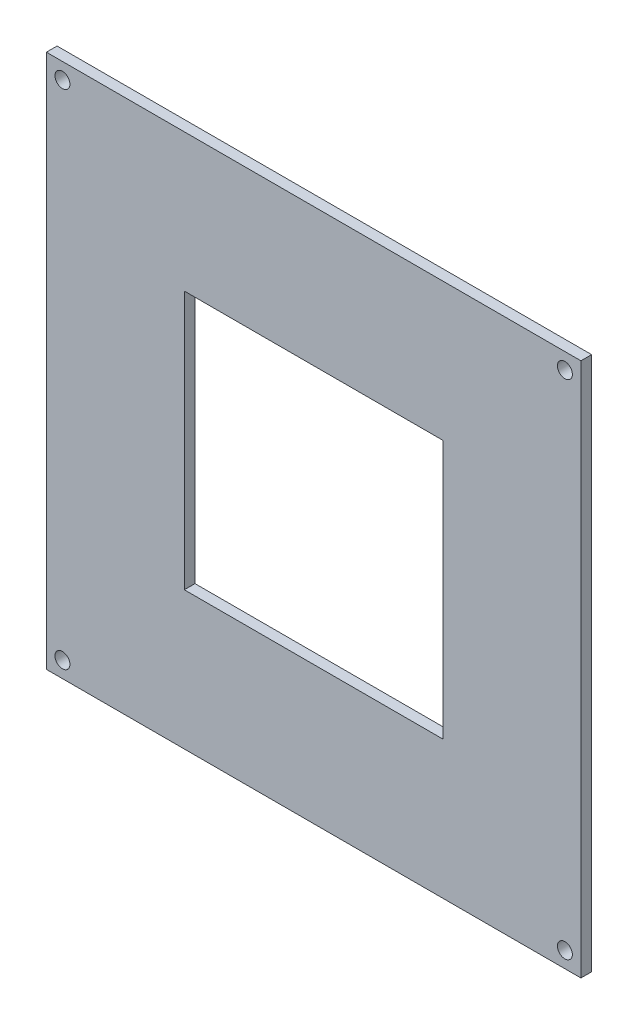
from build123d import *

# Parameters (mm, degrees)
ESBO_O1_W                = 250
ESBO_O1_H                = 250
RESSALTO_EXTRUS_O1_DEPTH = 5
ESBO_O2_R                = 3.5
CORTE_EXTRUS_O1_DEPTH    = 177.847391838
ESBO_O3_W                = 121
ESBO_O3_H                = 121
CORTE_EXTRUS_O2_DEPTH    = 177.847391838


with BuildPart() as part:
    # Esboço1 → Ressalto-extrusão1 (new body)
    with BuildSketch(Plane.XY):
        Rectangle(ESBO_O1_W, ESBO_O1_H)
    extrude(amount=RESSALTO_EXTRUS_O1_DEPTH)

    # Esboço2 → Corte-extrusão1 (cut, through all)
    with BuildSketch(Plane.XY.offset(5)):
        with Locations((-117.5, 117.5)):
            Circle(ESBO_O2_R)
        with Locations(Location((117.5, 117.5, 0), (0, 0, 180))):
            Circle(ESBO_O2_R)
        with Locations(Location((-117.5, -117.5, 0), (0, 0, 180))):
            Circle(ESBO_O2_R)
        with Locations((117.5, -117.5)):
            Circle(ESBO_O2_R)
    extrude(amount=-CORTE_EXTRUS_O1_DEPTH, mode=Mode.SUBTRACT)

    # Esboço3 → Corte-extrusão2 (cut, through all)
    with BuildSketch(Plane.XY.offset(5)):
        Rectangle(ESBO_O3_W, ESBO_O3_H)
    extrude(amount=-CORTE_EXTRUS_O2_DEPTH, mode=Mode.SUBTRACT)


solid = part.part
